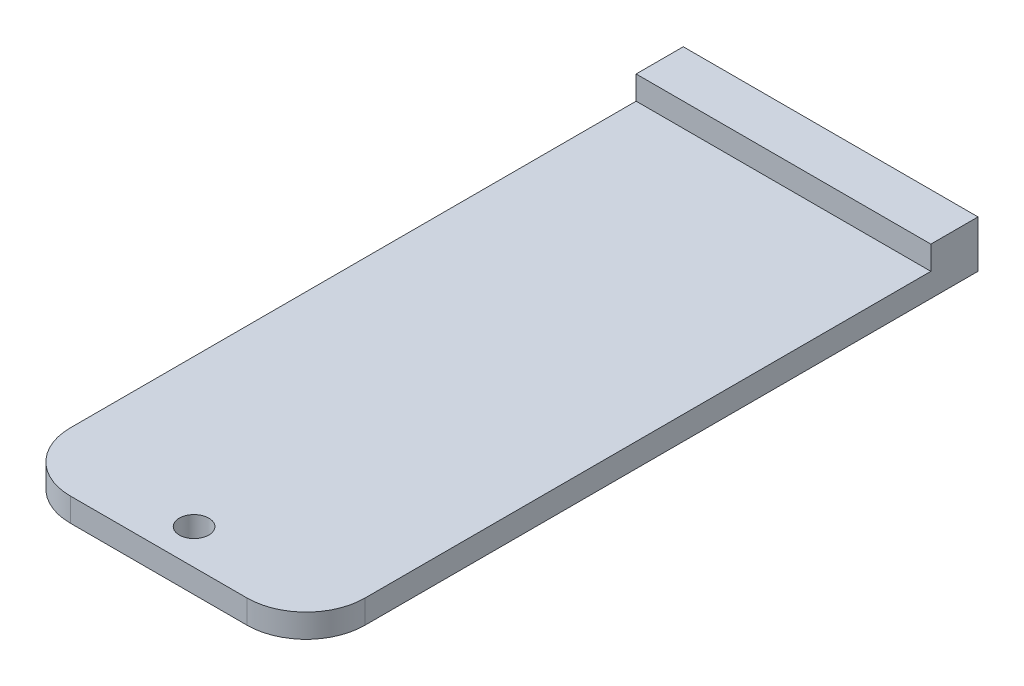
from build123d import *

# Parameters (mm, degrees)
SCHIZZO1_W                   = 25
SCHIZZO1_H                   = 2
ESTRUSIONE_ESTRUSIONE1_DEPTH = 47
SCHIZZO2_W                   = 25
SCHIZZO2_H                   = 2
ESTRUSIONE_ESTRUSIONE2_DEPTH = 6
FORO_FILETTATO_M3X0_5_1_D    = 2.5
RACCORDO1_R                  = 5
ESTRUSIONE_ESTRUSIONE3_DEPTH = 4


with BuildPart() as part:
    # Schizzo1 → Estrusione-Estrusione1 (new body)
    with BuildSketch(Plane.XY):
        with Locations((-25, 9)):
            Rectangle(SCHIZZO1_W, SCHIZZO1_H)
    extrude(amount=-ESTRUSIONE_ESTRUSIONE1_DEPTH)

    # Schizzo2 → Estrusione-Estrusione2 (add)
    with BuildSketch(Plane.XY):
        with Locations((-25, 9)):
            Rectangle(SCHIZZO2_W, SCHIZZO2_H)
    extrude(amount=ESTRUSIONE_ESTRUSIONE2_DEPTH)

    # Foro filettato M3x0.5-1 (through all)
    with Locations(Plane(origin=(0, 10, 0), x_dir=(1, 0, 0), z_dir=(0, 1, 0))):
        with Locations((-25, -3)):
            Hole(FORO_FILETTATO_M3X0_5_1_D / 2)

    # Raccordo1
    raccordo1_edges = [part.edges().sort_by_distance(p)[0] for p in [
        (-37.5, 9, 6),
        (-12.5, 9, 6),
    ]]
    fillet(raccordo1_edges, radius=RACCORDO1_R)

    # Schizzo5 → Estrusione-Estrusione3 (add)
    with BuildSketch(Plane(origin=(0, 0, -47), x_dir=(-1, 0, 0), z_dir=(0, 0, -1))):
        Polygon((12.5, 10), (12.5, 12), (37.5, 12), (37.5, 10), (37.5, 8), (12.5, 8), align=None)
    extrude(amount=ESTRUSIONE_ESTRUSIONE3_DEPTH)


solid = part.part
